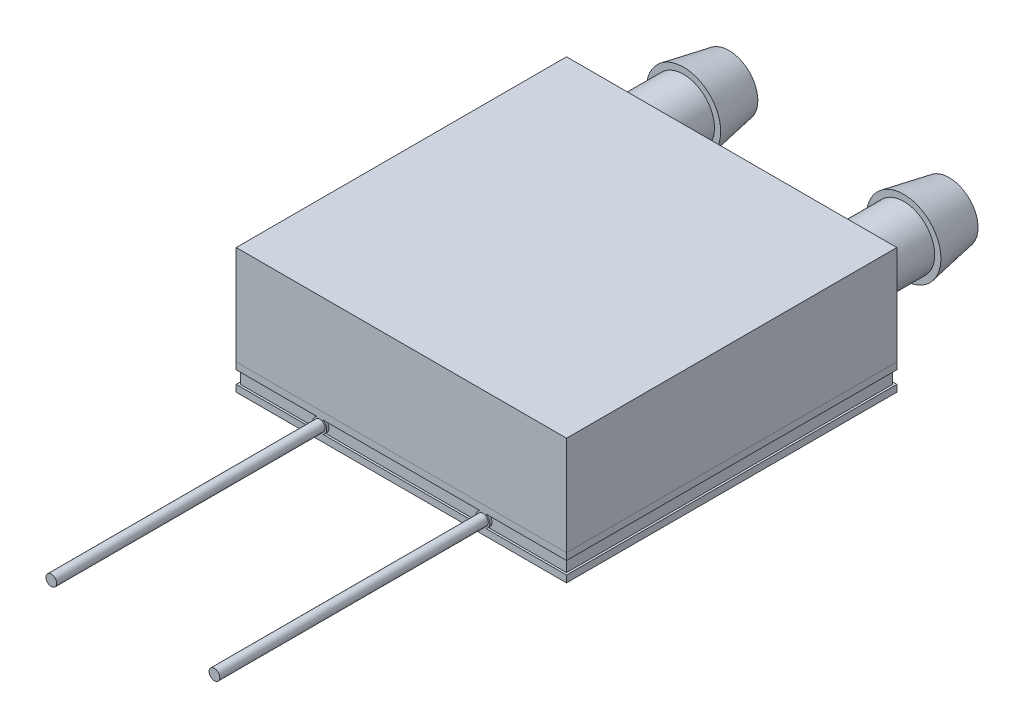
from build123d import *

# Parameters (mm, degrees)
SKETCH1_W               = 40
SKETCH1_H               = 40
BOSS_EXTRUDE1_DEPTH     = 3.175
CUT_EXTRUDE1_DEPTH      = 0.762
CUT_EXTRUDE1_DEPTH_BACK = 0.762
SKETCH2_W               = 40
SKETCH2_H               = 40
SKETCH2_W_2             = 39.492
SKETCH2_H_2             = 39.492
SKETCH3_R               = 0.838059787
BOSS_EXTRUDE2_DEPTH     = 0.254
SKETCH4_R               = 0.649805147
BOSS_EXTRUDE3_DEPTH     = 32.512
BOSS_EXTRUDE3_2_DEPTH   = 32.512
SKETCH5_W               = 40
SKETCH5_H               = 40
BOSS_EXTRUDE4_DEPTH     = 12
CUT_SWEEP1_PROFILE_R    = 3
SKETCH16_W              = 0.75
SKETCH16_H              = 6.5


with BuildPart() as part:
    # Sketch1 → Boss-Extrude1 (new body)
    with BuildSketch(Plane(origin=(0, 0, 0), x_dir=(1, 0, 0), z_dir=(0, 1, 0))):
        with Locations((20, 20)):
            Rectangle(SKETCH1_W, SKETCH1_H)
    extrude(amount=BOSS_EXTRUDE1_DEPTH)

    # Sketch2 → Cut-Extrude1 (cut, two sides: drawn at the far end of the back side and taken through both)
    with BuildSketch(Plane(origin=(0, 1.5875, 0), x_dir=(1, 0, 0), z_dir=(0, 1, 0)).offset(-CUT_EXTRUDE1_DEPTH_BACK)):
        with Locations((20, 20)):
            Rectangle(SKETCH2_W, SKETCH2_H)
        with Locations((20, 20)):
            Rectangle(SKETCH2_W_2, SKETCH2_H_2, mode=Mode.SUBTRACT)
    extrude(amount=CUT_EXTRUDE1_DEPTH + CUT_EXTRUDE1_DEPTH_BACK, mode=Mode.SUBTRACT)

    # Sketch3 → Boss-Extrude2 (add)
    with BuildSketch(Plane.XY.offset(-0.254)):
        with Locations((10.127, 1.5875)):
            Circle(SKETCH3_R)
        with Locations((29.873, 1.5875)):
            Circle(SKETCH3_R)
    extrude(amount=BOSS_EXTRUDE2_DEPTH)


with BuildPart() as body_2:
    # Sketch4 → Boss-Extrude3 (new body)
    with BuildSketch(Plane.XY):
        with Locations((10.127, 1.5875)):
            Circle(SKETCH4_R)
    extrude(amount=BOSS_EXTRUDE3_DEPTH)


with BuildPart() as body_3:
    # Sketch4 → Boss-Extrude3 2 (new body)
    with BuildSketch(Plane.XY):
        with Locations((29.873, 1.5875)):
            Circle(SKETCH4_R)
    extrude(amount=BOSS_EXTRUDE3_2_DEPTH)


with BuildPart() as body_4:
    # Sketch5 → Boss-Extrude4 (new body)
    with BuildSketch(Plane(origin=(0, 3.175, 0), x_dir=(1, 0, 0), z_dir=(0, 1, 0))):
        with Locations((20, 20)):
            Rectangle(SKETCH5_W, SKETCH5_H)
    extrude(amount=BOSS_EXTRUDE4_DEPTH)

    # Cut-Sweep1: sweep along a path in Sketch7
    with BuildLine(Plane(origin=(0, 9.175000062, 0), x_dir=(1, 0, 0), z_dir=(0, 1, 0))) as cut_sweep1_path:
        Line((6.666666667, 40), (6.666666667, 6.666666667))
        Line((6.666666667, 6.666666667), (15.555555559, 6.666666667))
        Line((15.555555559, 6.666666667), (15.555555559, 33.333333333))
        Line((15.555555559, 33.333333333), (24.444444441, 33.333333333))
        Line((24.444444441, 33.333333333), (24.444444441, 6.666666667))
        Line((24.444444441, 6.666666667), (33.333333333, 6.666666667))
        Line((33.333333333, 6.666666667), (33.333333333, 40))
    # Cut-Sweep1 profile (on start of the path) → Cut-Sweep1 (sweep, cut)
    with BuildSketch(Plane(origin=(6.666666667, 9.175000062, -40), x_dir=(1, 0, 0), z_dir=(0, 0, 1))):
        Circle(CUT_SWEEP1_PROFILE_R)
    sweep(path=cut_sweep1_path.line, transition=Transition.RIGHT, mode=Mode.SUBTRACT)

    # Sketch16 → Revolve1 (revolve)
    with BuildSketch(Plane(origin=(0, 9.175000062, 0), x_dir=(1, 0, 0), z_dir=(0, 1, 0))):
        Polygon((9.666666667, 53), (9.666666667, 47.5), (10.416666667, 47.5), (11.166666667, 47.5), (10.166666667, 53), align=None)
        with Locations((10.041666667, 44.25)):
            Rectangle(SKETCH16_W, SKETCH16_H)
        Polygon((9.666666667, 41), (9.666666667, 40), (11.166666667, 40), (11.166666667, 41), (10.416666667, 41), align=None)
    revolve1 = revolve(axis=Axis((6.666666667, 9.175000062, -40), (0, 0, -1)))

    # Mirror1: Revolve1 across plane
    add(revolve1.mirror(Plane(origin=(20, 0, 0), x_dir=(0, 0, 1), z_dir=(1, 0, 0))))


solid = Compound([part.part, body_2.part, body_3.part, body_4.part])
